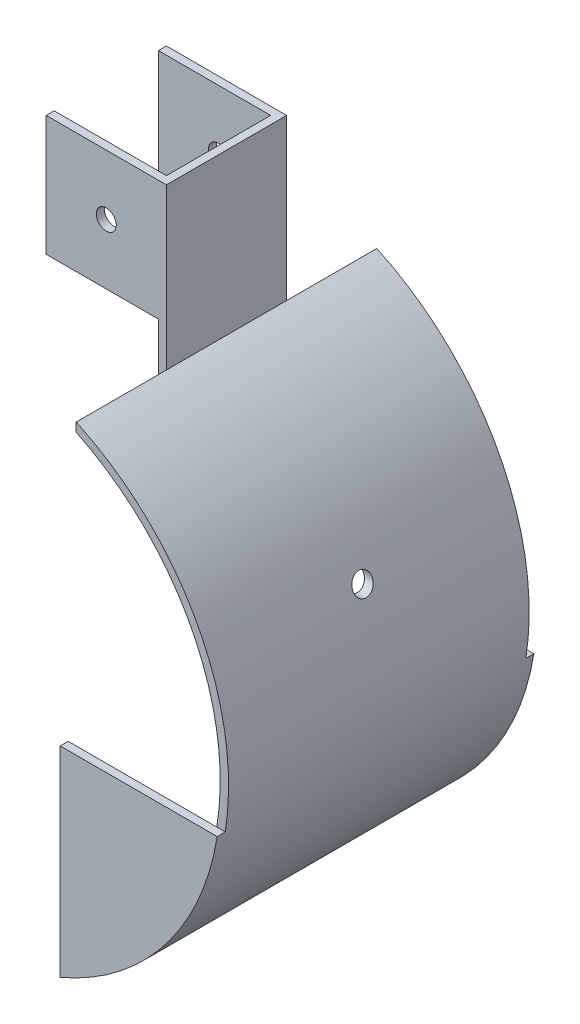
from build123d import *
from build123d.topology import SkipClean

# Parameters (mm, degrees)
SKETCH1_W           = 30
SKETCH1_H           = 30
SKETCH1_W_2         = 2
SKETCH1_H_2         = 10
BOSS_EXTRUDE1_DEPTH = 75
SKETCH2_W           = 30
SKETCH2_H           = 22.5
CUT_EXTRUDE1_DEPTH  = 75
SKETCH3_W           = 26
SKETCH3_H           = 30.082215134
CUT_EXTRUDE2_DEPTH  = 28
SKETCH5_R           = 2.5
CUT_EXTRUDE3_DEPTH  = 38
BOSS_EXTRUDE2_DEPTH = 2
BOSS_EXTRUDE3_START = 2
BOSS_EXTRUDE3_DEPTH = 2
SKETCH9_R           = 2.5
CUT_EXTRUDE4_DEPTH  = 169.967145294


with BuildPart() as part:
    # Sketch1 → Boss-Extrude1 (new body)
    with BuildSketch(Plane.XY):
        Rectangle(SKETCH1_W, SKETCH1_H)
        with BuildLine():
            Line((50.917737084, -85.641756384), (53, -85.641756384))
            ThreePointArc((53, -85.641756384), (42.989370072, -49.687860894), (15, -25))
            Line((15, -25), (14.157929479, -26.814088542))
            ThreePointArc((14.157929479, -26.814088542), (41.246515654, -50.786104008), (50.917737084, -85.641756384))
        make_face()
        with Locations((14, -20)):
            Rectangle(SKETCH1_W_2, SKETCH1_H_2)
        Polygon((14.157929479, -26.814088542), (15, -25), (13, -25), (13, -26.814088542), align=None)
        with BuildLine():
            Line((12.135037198, -143.180046466), (13, -144.983332176))
            ThreePointArc((13, -144.983332176), (41.796634815, -121.242036174), (53, -85.641756384))
            Line((53, -85.641756384), (50.917737084, -85.641756384))
            ThreePointArc((50.917737084, -85.641756384), (40.047121172, -120.154156399), (12.135037198, -143.180046466))
        make_face()
    extrude(amount=BOSS_EXTRUDE1_DEPTH)

    # Sketch2 → Cut-Extrude1 (cut)
    with BuildSketch(Plane(origin=(0, 15, 0), x_dir=(1, 0, 0), z_dir=(0, 1, 0))):
        with Locations((0, -11.25)):
            Rectangle(SKETCH2_W, SKETCH2_H)
        with Locations((0, -63.75)):
            Rectangle(SKETCH2_W, SKETCH2_H)
    extrude(amount=-CUT_EXTRUDE1_DEPTH, mode=Mode.SUBTRACT)

    # Sketch3 → Cut-Extrude2 (cut)
    with BuildSketch(Plane.ZY.offset(15)):
        with Locations((37.5, 0.030332794)):
            Rectangle(SKETCH3_W, SKETCH3_H)
    extrude(amount=-CUT_EXTRUDE2_DEPTH, mode=Mode.SUBTRACT)

    # Sketch5 → Cut-Extrude3 (cut)
    with BuildSketch(Plane.XY.offset(52.5)):
        Circle(SKETCH5_R)
    extrude(amount=-CUT_EXTRUDE3_DEPTH, mode=Mode.SUBTRACT)

    # Sketch6 → Boss-Extrude2 (add)
    with SkipClean():  # the faces are left unmerged after this step: merging them gives an invalid solid
        with BuildSketch(Plane.XY.offset(75)):
            with BuildLine():
                Line((13, -144.983332176), (13, -94.983332176))
                Line((13, -94.983332176), (52.174379027, -94.983332176))
                ThreePointArc((52.174379027, -94.983332176), (39.036739849, -125.036474764), (13, -144.983332176))
            make_face()
        extrude(amount=BOSS_EXTRUDE2_DEPTH)

    # Sketch7 → Boss-Extrude3 (add)
    with SkipClean():  # the faces are left unmerged after this step: merging them gives an invalid solid
        with BuildSketch(Plane(origin=(0, 0, 0), x_dir=(-1, 0, 0), z_dir=(0, 0, -1)).offset(BOSS_EXTRUDE3_START)):
            with BuildLine():
                Line((-13, -144.983332176), (-13, -94.983332176))
                Line((-13, -94.983332176), (-52.174379027, -94.983332176))
                ThreePointArc((-52.174379027, -94.983332176), (-39.036739849, -125.036474764), (-13, -144.983332176))
            make_face()
        extrude(amount=-BOSS_EXTRUDE3_DEPTH)

    # Sketch9 → Cut-Extrude4 (cut, through all)
    with SkipClean():  # the faces are left unmerged after this step: merging them gives an invalid solid
        with BuildSketch(Plane.ZY.offset(-13)):
            with Locations((37.5, -61.814088542)):
                Circle(SKETCH9_R)
        extrude(amount=-CUT_EXTRUDE4_DEPTH, mode=Mode.SUBTRACT)


solid = part.part
